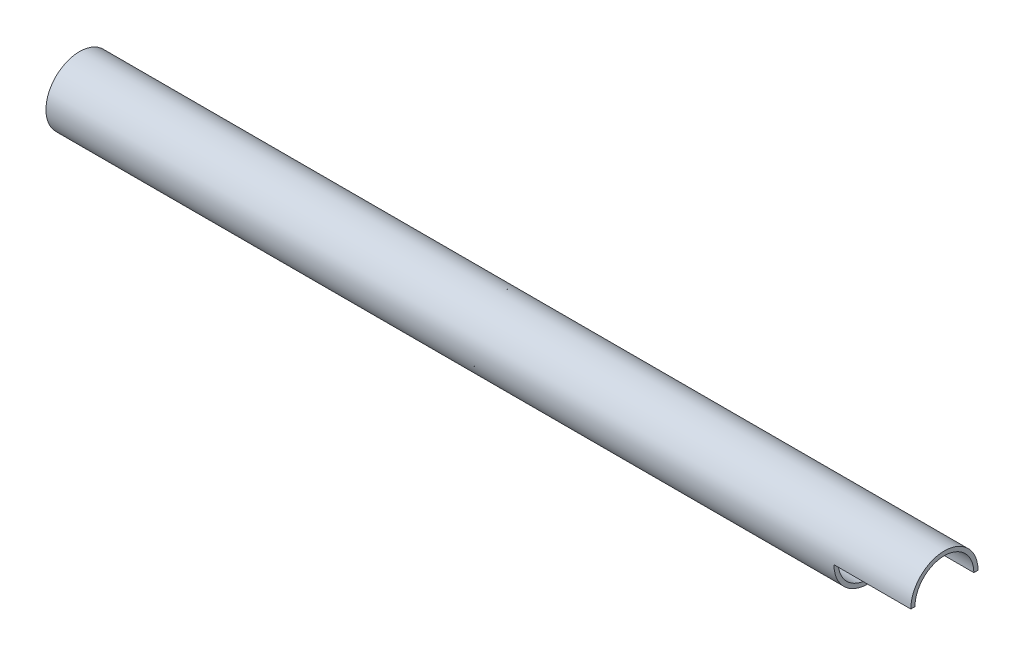
from build123d import *

# Parameters (mm, degrees)
CROQUIS1_R              = 44.45
CROQUIS1_R_2            = 38.95
SALIENTE_EXTRUIR1_DEPTH = 1144
CORTAR_EXTRUIR1_START   = -101.6
CORTAR_EXTRUIR1_DEPTH   = 101.6


with BuildPart() as part:
    # Croquis1 → Saliente-Extruir1 (new body)
    with BuildSketch(Plane(origin=(0, 0, 0), x_dir=(0, 0, -1), z_dir=(1, 0, 0))):
        Circle(CROQUIS1_R)
        Circle(CROQUIS1_R_2, mode=Mode.SUBTRACT)
    extrude(amount=SALIENTE_EXTRUIR1_DEPTH)

    # Croquis3 → Cortar-Extruir1 (cut)
    with BuildSketch(Plane(origin=(1144, 0, 0), x_dir=(0, 0, -1), z_dir=(1, 0, 0)).offset(CORTAR_EXTRUIR1_START)):
        with BuildLine():
            Line((-44.45, 0), (-38.95, 0))
            ThreePointArc((-38.95, 0), (0, -38.95), (38.95, 0))
            Line((38.95, 0), (44.45, 0))
            ThreePointArc((44.45, 0), (0, -44.45), (-44.45, 0))
        make_face()
    extrude(amount=CORTAR_EXTRUIR1_DEPTH, mode=Mode.SUBTRACT)


solid = part.part
